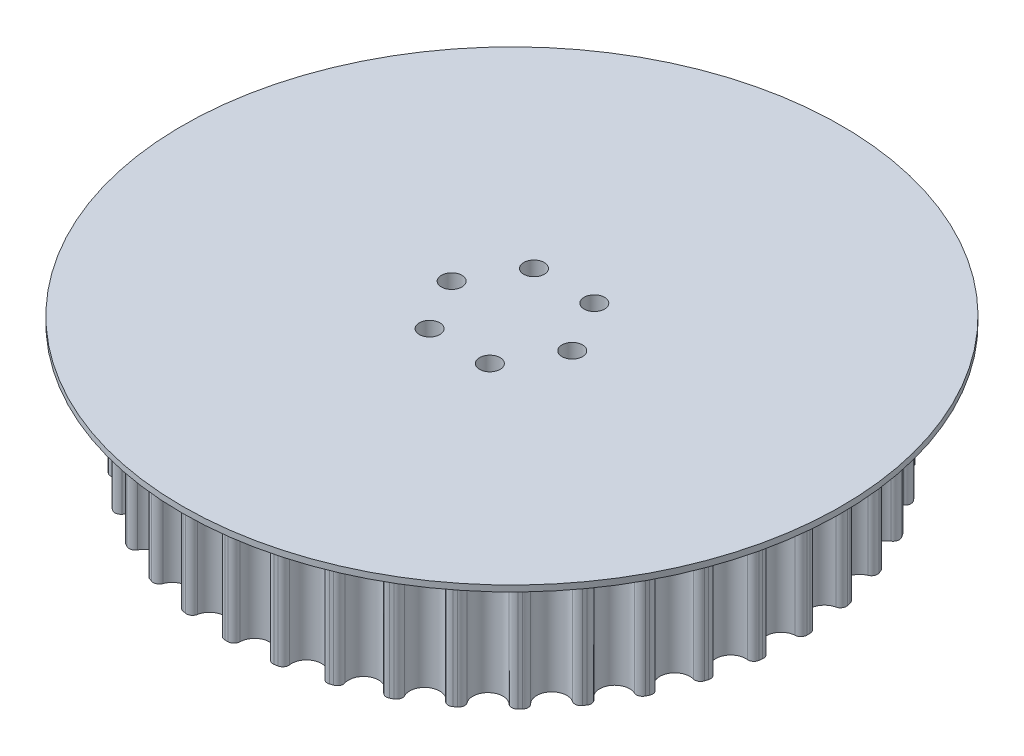
from build123d import *

# Parameters (mm, degrees)
BOSS_EXTRUDE3_DEPTH = 11
SKETCH2_R           = 54.656342245
BOSS_EXTRUDE2_DEPTH = 1
SKETCH3_R           = 1.7
CUT_EXTRUDE1_DEPTH  = 81.645095915
SKETCH4_R           = 3
CUT_EXTRUDE2_DEPTH  = 13
SKETCH6_R           = 1.985
CUT_EXTRUDE3_DEPTH  = 20


with BuildPart() as part:
    # Sketch5 → Boss-Extrude3 (new, symmetric)
    with BuildSketch(Plane(origin=(0, 0, 0), x_dir=(1, 0, 0), z_dir=(0, 1, 0))):
        with BuildLine():
            ThreePointArc((46.375129355, 0.610310087), (47.056181167, 0.935095402), (47.316413888, 1.643329827))
            ThreePointArc((47.316413888, 1.643329827), (47.311662479, 1.774866077), (47.30654541, 1.906388609))
            ThreePointArc((47.30654541, 1.906388609), (47.301062719, 2.037896407), (47.29521445, 2.169388454))
            ThreePointArc((47.29521445, 2.169388454), (46.978836389, 2.85438626), (46.273858659, 3.123316493))
            ThreePointArc((46.273858659, 3.123316493), (43.747034413, 5.311851679), (45.676682987, 8.041500632))
            ThreePointArc((45.676682987, 8.041500632), (46.296816128, 8.471328455), (46.440070113, 9.212135695))
            ThreePointArc((46.440070113, 9.212135695), (46.414280335, 9.341206405), (46.388131833, 9.470204919))
            ThreePointArc((46.388131833, 9.470204919), (46.361624807, 9.59913024), (46.334759464, 9.727981372))
            ThreePointArc((46.334759464, 9.727981372), (45.91259704, 10.353358026), (45.173609143, 10.505719303))
            ThreePointArc((45.173609143, 10.505719303), (42.328440876, 12.260582418), (43.795234522, 15.264420534))
            ThreePointArc((43.795234522, 15.264420534), (44.33838787, 15.788158551), (44.360952916, 16.542352087))
            ThreePointArc((44.360952916, 16.542352087), (44.314792711, 16.665614394), (44.268290008, 16.788747897))
            ThreePointArc((44.268290008, 16.788747897), (44.221445165, 16.911751643), (44.174258546, 17.034624682))
            ThreePointArc((44.174258546, 17.034624682), (43.657245545, 17.584183257), (42.903386879, 17.616029501))
            ThreePointArc((42.903386879, 17.616029501), (39.813562954, 18.891770514), (40.779512488, 22.091999962))
            ThreePointArc((40.779512488, 22.091999962), (41.231618657, 22.696083634), (41.132910339, 23.44413025))
            ThreePointArc((41.132910339, 23.44413025), (41.067575233, 23.558391725), (41.001922725, 23.672471122))
            ThreePointArc((41.001922725, 23.672471122), (40.935953322, 23.786367561), (40.869667536, 23.900080161))
            ThreePointArc((40.869667536, 23.900080161), (40.271194322, 24.359587379), (39.521989432, 24.270093788))
            ThreePointArc((39.521989432, 24.270093788), (36.267534664, 25.033671676), (36.707622501, 28.347408196))
            ThreePointArc((36.707622501, 28.347408196), (37.056972178, 29.016192073), (36.839546992, 29.738717753))
            ThreePointArc((36.839546992, 29.738717753), (36.756729128, 29.841019084), (36.67362718, 29.94308978))
            ThreePointArc((36.67362718, 29.94308978), (36.590241791, 30.044929054), (36.506573604, 30.146536117))
            ThreePointArc((36.506573604, 30.146536117), (35.84214032, 30.504090983), (35.116993217, 30.295575394))
            ThreePointArc((35.116993217, 30.295575394), (31.782196277, 30.527213892), (31.685024373, 33.868633447))
            ThreePointArc((31.685024373, 33.868633447), (31.922569585, 34.584796378), (31.592058728, 35.263088088))
            ThreePointArc((31.592058728, 35.263088088), (31.493903046, 35.350779724), (31.395503956, 35.438198142))
            ThreePointArc((31.395503956, 35.438198142), (31.296862217, 35.525342666), (31.197978592, 35.612212624))
            ThreePointArc((31.197978592, 35.612212624), (30.48479371, 35.858554654), (29.802485325, 35.536417511))
            ThreePointArc((29.802485325, 35.536417511), (26.473715701, 35.230117303), (25.841800757, 38.512678883))
            ThreePointArc((25.841800757, 38.512678883), (25.961389208, 39.257672623), (25.526352737, 39.874162964))
            ThreePointArc((25.526352737, 39.874162964), (25.415401418, 39.944973738), (25.30425367, 40.015475786))
            ThreePointArc((25.30425367, 40.015475786), (25.192910351, 40.085668564), (25.081372321, 40.155551529))
            ThreePointArc((25.081372321, 40.155551529), (24.337906956, 40.284300594), (23.716108717, 39.856885082))
            ThreePointArc((23.716108717, 39.856885082), (20.479579795, 39.020579181), (19.329288075, 42.159266165))
            ThreePointArc((19.329288075, 42.159266165), (19.327822487, 42.913795769), (18.799527619, 43.452517964))
            ThreePointArc((18.799527619, 43.452517964), (18.678654244, 43.504613914), (18.557636506, 43.556373626))
            ThreePointArc((18.557636506, 43.556373626), (18.43647534, 43.607796702), (18.315171683, 43.658882743))
            ThreePointArc((18.315171683, 43.658882743), (17.560681197, 43.66670431), (17.015497351, 43.145080264))
            ThreePointArc((17.015497351, 43.145080264), (13.955033529, 41.800428555), (12.316156985, 44.713950599))
            ThreePointArc((12.316156985, 44.713950599), (12.193675316, 45.458474146), (11.585804611, 45.905475574))
            ThreePointArc((11.585804611, 45.905475574), (11.458139736, 45.937507442), (11.330386304, 45.969184269))
            ThreePointArc((11.330386304, 45.969184269), (11.202545302, 46.000505811), (11.074617718, 46.031471827))
            ThreePointArc((11.074617718, 46.031471827), (10.328643018, 45.918163321), (9.874193542, 45.315840531))
            ThreePointArc((9.874193542, 45.315840531), (7.069059225, 43.497668787), (4.984043899, 46.1105672))
            ThreePointArc((4.984043899, 46.1105672), (4.74371836, 46.825801921), (4.072015349, 47.169505479))
            ThreePointArc((4.072015349, 47.169505479), (3.940865428, 47.180643656), (3.809685049, 47.191417186))
            ThreePointArc((3.809685049, 47.191417186), (3.678475225, 47.201825983), (3.547236972, 47.21186997))
            ThreePointArc((3.547236972, 47.21186997), (2.829098411, 46.980366022), (2.477153306, 46.312944331))
            ThreePointArc((2.477153306, 46.312944331), (0, 44.068342245), (-2.477153306, 46.312944331))
            ThreePointArc((-2.477153306, 46.312944331), (-2.829098411, 46.980366022), (-3.547236972, 47.21186997))
            ThreePointArc((-3.547236972, 47.21186997), (-3.678475225, 47.201825983), (-3.809685049, 47.191417186))
            ThreePointArc((-3.809685049, 47.191417186), (-3.940865428, 47.180643656), (-4.072015349, 47.169505479))
            ThreePointArc((-4.072015349, 47.169505479), (-4.74371836, 46.825801921), (-4.984043899, 46.1105672))
            ThreePointArc((-4.984043899, 46.1105672), (-7.069059225, 43.497668787), (-9.874193542, 45.315840531))
            ThreePointArc((-9.874193542, 45.315840531), (-10.328643018, 45.918163321), (-11.074617718, 46.031471827))
            ThreePointArc((-11.074617718, 46.031471827), (-11.202545302, 46.000505811), (-11.330386304, 45.969184269))
            ThreePointArc((-11.330386304, 45.969184269), (-11.458139736, 45.937507442), (-11.585804611, 45.905475574))
            ThreePointArc((-11.585804611, 45.905475574), (-12.193675316, 45.458474146), (-12.316156985, 44.713950599))
            ThreePointArc((-12.316156985, 44.713950599), (-13.955033529, 41.800428555), (-17.015497351, 43.145080264))
            ThreePointArc((-17.015497351, 43.145080264), (-17.560681197, 43.66670431), (-18.315171683, 43.658882743))
            ThreePointArc((-18.315171683, 43.658882743), (-18.43647534, 43.607796702), (-18.557636506, 43.556373626))
            ThreePointArc((-18.557636506, 43.556373626), (-18.678654244, 43.504613914), (-18.799527619, 43.452517964))
            ThreePointArc((-18.799527619, 43.452517964), (-19.327822487, 42.913795769), (-19.329288075, 42.159266165))
            ThreePointArc((-19.329288075, 42.159266165), (-20.479579795, 39.020579181), (-23.716108717, 39.856885082))
            ThreePointArc((-23.716108717, 39.856885082), (-24.337906956, 40.284300594), (-25.081372321, 40.155551529))
            ThreePointArc((-25.081372321, 40.155551529), (-25.192910351, 40.085668564), (-25.30425367, 40.015475786))
            ThreePointArc((-25.30425367, 40.015475786), (-25.415401418, 39.944973738), (-25.526352737, 39.874162964))
            ThreePointArc((-25.526352737, 39.874162964), (-25.961389208, 39.257672623), (-25.841800757, 38.512678883))
            ThreePointArc((-25.841800757, 38.512678883), (-26.473715701, 35.230117303), (-29.802485325, 35.536417511))
            ThreePointArc((-29.802485325, 35.536417511), (-30.48479371, 35.858554654), (-31.197978592, 35.612212624))
            ThreePointArc((-31.197978592, 35.612212624), (-31.296862217, 35.525342666), (-31.395503956, 35.438198142))
            ThreePointArc((-31.395503956, 35.438198142), (-31.493903046, 35.350779724), (-31.592058728, 35.263088088))
            ThreePointArc((-31.592058728, 35.263088088), (-31.922569585, 34.584796378), (-31.685024373, 33.868633447))
            ThreePointArc((-31.685024373, 33.868633447), (-31.782196277, 30.527213892), (-35.116993217, 30.295575394))
            ThreePointArc((-35.116993217, 30.295575394), (-35.84214032, 30.504090983), (-36.506573604, 30.146536117))
            ThreePointArc((-36.506573604, 30.146536117), (-36.590241791, 30.044929054), (-36.67362718, 29.94308978))
            ThreePointArc((-36.67362718, 29.94308978), (-36.756729128, 29.841019084), (-36.839546992, 29.738717753))
            ThreePointArc((-36.839546992, 29.738717753), (-37.056972178, 29.016192073), (-36.707622501, 28.347408196))
            ThreePointArc((-36.707622501, 28.347408196), (-36.267534664, 25.033671676), (-39.521989432, 24.270093788))
            ThreePointArc((-39.521989432, 24.270093788), (-40.271194322, 24.359587379), (-40.869667536, 23.900080161))
            ThreePointArc((-40.869667536, 23.900080161), (-40.935953322, 23.786367561), (-41.001922725, 23.672471122))
            ThreePointArc((-41.001922725, 23.672471122), (-41.067575233, 23.558391725), (-41.132910339, 23.44413025))
            ThreePointArc((-41.132910339, 23.44413025), (-41.231618657, 22.696083634), (-40.779512488, 22.091999962))
            ThreePointArc((-40.779512488, 22.091999962), (-39.813562954, 18.891770514), (-42.903386879, 17.616029501))
            ThreePointArc((-42.903386879, 17.616029501), (-43.657245545, 17.584183257), (-44.174258546, 17.034624682))
            ThreePointArc((-44.174258546, 17.034624682), (-44.221445165, 16.911751643), (-44.268290008, 16.788747897))
            ThreePointArc((-44.268290008, 16.788747897), (-44.314792711, 16.665614394), (-44.360952916, 16.542352087))
            ThreePointArc((-44.360952916, 16.542352087), (-44.33838787, 15.788158551), (-43.795234522, 15.264420534))
            ThreePointArc((-43.795234522, 15.264420534), (-42.328440876, 12.260582418), (-45.173609143, 10.505719303))
            ThreePointArc((-45.173609143, 10.505719303), (-45.91259704, 10.353358026), (-46.334759464, 9.727981372))
            ThreePointArc((-46.334759464, 9.727981372), (-46.361624807, 9.59913024), (-46.388131833, 9.470204919))
            ThreePointArc((-46.388131833, 9.470204919), (-46.414280335, 9.341206405), (-46.440070113, 9.212135695))
            ThreePointArc((-46.440070113, 9.212135695), (-46.296816128, 8.471328455), (-45.676682987, 8.041500632))
            ThreePointArc((-45.676682987, 8.041500632), (-43.747034413, 5.311851679), (-46.273858659, 3.123316493))
            ThreePointArc((-46.273858659, 3.123316493), (-46.978836389, 2.85438626), (-47.29521445, 2.169388454))
            ThreePointArc((-47.29521445, 2.169388454), (-47.301062719, 2.037896407), (-47.30654541, 1.906388609))
            ThreePointArc((-47.30654541, 1.906388609), (-47.311662479, 1.774866077), (-47.316413888, 1.643329827))
            ThreePointArc((-47.316413888, 1.643329827), (-47.056181167, 0.935095402), (-46.375129355, 0.610310087))
            ThreePointArc((-46.375129355, 0.610310087), (-44.032602739, -1.77445323), (-46.175639542, -4.339978573))
            ThreePointArc((-46.175639542, -4.339978573), (-46.828348552, -4.718512611), (-47.030748225, -5.445390485))
            ThreePointArc((-47.030748225, -5.445390485), (-47.015427953, -5.576117873), (-46.99974431, -5.706802165))
            ThreePointArc((-46.99974431, -5.706802165), (-46.983697417, -5.83744235), (-46.967287398, -5.96803742))
            ThreePointArc((-46.967287398, -5.96803742), (-46.59681583, -6.625356131), (-45.872484232, -6.836687168))
            ThreePointArc((-45.872484232, -6.836687168), (-43.177749782, -8.814800731), (-44.881495615, -11.690870473))
            ThreePointArc((-44.881495615, -11.690870473), (-45.465031086, -12.169204484), (-45.548210325, -12.919136671))
            ThreePointArc((-45.548210325, -12.919136671), (-45.512118299, -13.045713629), (-45.47567452, -13.172189761))
            ThreePointArc((-45.47567452, -13.172189761), (-45.438879271, -13.298564087), (-45.401732835, -13.424835632))
            ThreePointArc((-45.401732835, -13.424835632), (-44.93061744, -14.01421442), (-44.181765864, -14.106617816))
            ThreePointArc((-44.181765864, -14.106617816), (-41.204615787, -15.626849524), (-42.424944528, -18.73897497))
            ThreePointArc((-42.424944528, -18.73897497), (-42.924193196, -19.304720352), (-42.885997703, -20.058284003))
            ThreePointArc((-42.885997703, -20.058284003), (-42.830068687, -20.177432255), (-42.773808648, -20.29642456))
            ThreePointArc((-42.773808648, -20.29642456), (-42.717218019, -20.41526), (-42.66029724, -20.533937654))
            ThreePointArc((-42.66029724, -20.533937654), (-42.10073966, -21.040111918), (-41.346762967, -21.011194474))
            ThreePointArc((-41.346762967, -21.011194474), (-38.164303887, -22.034171122), (-38.869609662, -25.301749857))
            ThreePointArc((-38.869609662, -25.301749857), (-39.271641249, -25.940254104), (-39.113060268, -26.677932316))
            ThreePointArc((-39.113060268, -26.677932316), (-39.038742794, -26.786565984), (-38.964123599, -26.894992625))
            ThreePointArc((-38.964123599, -26.894992625), (-38.889203259, -27.003211402), (-38.813982354, -27.111221476))
            ThreePointArc((-38.813982354, -27.111221476), (-38.180474836, -27.521081568), (-37.440900628, -27.37159223))
            ThreePointArc((-37.440900628, -27.37159223), (-34.135556562, -27.870819263), (-34.307572323, -31.209222714))
            ThreePointArc((-34.307572323, -31.209222714), (-34.601974422, -31.903948901), (-34.327115117, -32.606636195))
            ThreePointArc((-34.327115117, -32.606636195), (-34.236333969, -32.701941724), (-34.145288216, -32.796994508))
            ThreePointArc((-34.145288216, -32.796994508), (-34.053978563, -32.891793812), (-33.962405714, -32.986338903))
            ThreePointArc((-33.962405714, -32.986338903), (-33.27135577, -33.289269662), (-32.56533863, -33.023080126))
            ThreePointArc((-32.56533863, -33.023080126), (-29.222716254, -32.985627824), (-28.856986881, -36.308393096))
            ThreePointArc((-28.856986881, -36.308393096), (-29.036134634, -37.041348179), (-28.652115715, -37.690845324))
            ThreePointArc((-28.652115715, -37.690845324), (-28.547222077, -37.770354351), (-28.442107804, -37.849571461))
            ThreePointArc((-28.442107804, -37.849571461), (-28.336773709, -37.928496041), (-28.231220606, -38.00712748))
            ThreePointArc((-28.231220606, -38.00712748), (-27.500526065, -38.195283158), (-26.846351467, -37.819287593))
            ThreePointArc((-26.846351467, -37.819287593), (-23.553022944, -37.246125952), (-22.659020638, -40.467195169))
            ThreePointArc((-22.659020638, -40.467195169), (-22.71827421, -41.219395996), (-22.235041567, -41.798881357))
            ThreePointArc((-22.235041567, -41.798881357), (-22.118752129, -41.860534641), (-22.00229174, -41.921864395))
            ThreePointArc((-22.00229174, -41.921864395), (-21.885661301, -41.982870144), (-21.768861713, -42.043551418))
            ThreePointArc((-21.768861713, -42.043551418), (-21.017447181, -42.112058883), (-20.432057902, -41.635995376))
            ThreePointArc((-20.432057902, -41.635995376), (-17.273318712, -40.541968981), (-15.874197662, -43.577918143))
            ThreePointArc((-15.874197662, -43.577918143), (-15.812022418, -44.329883109), (-15.242091521, -44.824348319))
            ThreePointArc((-15.242091521, -44.824348319), (-15.117418119, -44.866549071), (-14.992627877, -44.908403061))
            ThreePointArc((-14.992627877, -44.908403061), (-14.867721761, -44.949909964), (-14.742700736, -44.99106946))
            ThreePointArc((-14.742700736, -44.99106946), (-13.990027455, -44.938154403), (-13.48858477, -44.37435275))
            ThreePointArc((-13.48858477, -44.37435275), (-10.546244598, -42.78779631), (-8.678241305, -45.559995928))
            ThreePointArc((-8.678241305, -45.559995928), (-8.496247551, -46.292249534), (-7.854379312, -46.688888205))
            ThreePointArc((-7.854379312, -46.688888205), (-7.72455092, -46.710543448), (-7.594662828, -46.731837677))
            ThreePointArc((-7.594662828, -46.731837677), (-7.464716038, -46.752770727), (-7.334711554, -46.773342435))
            ThreePointArc((-7.334711554, -46.773342435), (-6.600273367, -46.60037533), (-6.195764378, -45.963437696))
            ThreePointArc((-6.195764378, -45.963437696), (-3.546028289, -43.92544219), (-1.257523057, -46.36209375))
            ThreePointArc((-1.257523057, -46.36209375), (-0.960424335, -47.055671013), (-0.263242804, -47.34421041))
            ThreePointArc((-0.263242804, -47.34421041), (-0.131621911, -47.344759286), (0, -47.344942245))
            ThreePointArc((0, -47.344942245), (0.131621911, -47.344759286), (0.263242804, -47.34421041))
            ThreePointArc((0.263242804, -47.34421041), (0.960424335, -47.055671013), (1.257523057, -46.36209375))
            ThreePointArc((1.257523057, -46.36209375), (3.546028289, -43.92544219), (6.195764378, -45.963437696))
            ThreePointArc((6.195764378, -45.963437696), (6.600273367, -46.60037533), (7.334711554, -46.773342435))
            ThreePointArc((7.334711554, -46.773342435), (7.464716038, -46.752770727), (7.594662828, -46.731837677))
            ThreePointArc((7.594662828, -46.731837677), (7.72455092, -46.710543448), (7.854379312, -46.688888205))
            ThreePointArc((7.854379312, -46.688888205), (8.496247551, -46.292249534), (8.678241305, -45.559995928))
            ThreePointArc((8.678241305, -45.559995928), (10.546244598, -42.78779631), (13.48858477, -44.37435275))
            ThreePointArc((13.48858477, -44.37435275), (13.990027455, -44.938154403), (14.742700736, -44.99106946))
            ThreePointArc((14.742700736, -44.99106946), (14.867721761, -44.949909964), (14.992627877, -44.908403061))
            ThreePointArc((14.992627877, -44.908403061), (15.117418119, -44.866549071), (15.242091521, -44.824348319))
            ThreePointArc((15.242091521, -44.824348319), (15.812022418, -44.329883109), (15.874197662, -43.577918143))
            ThreePointArc((15.874197662, -43.577918143), (17.273318712, -40.541968981), (20.432057902, -41.635995376))
            ThreePointArc((20.432057902, -41.635995376), (21.017447181, -42.112058883), (21.768861713, -42.043551418))
            ThreePointArc((21.768861713, -42.043551418), (21.885661301, -41.982870144), (22.00229174, -41.921864395))
            ThreePointArc((22.00229174, -41.921864395), (22.118752129, -41.860534641), (22.235041567, -41.798881357))
            ThreePointArc((22.235041567, -41.798881357), (22.71827421, -41.219395996), (22.659020638, -40.467195169))
            ThreePointArc((22.659020638, -40.467195169), (23.553022944, -37.246125952), (26.846351467, -37.819287593))
            ThreePointArc((26.846351467, -37.819287593), (27.500526065, -38.195283158), (28.231220606, -38.00712748))
            ThreePointArc((28.231220606, -38.00712748), (28.336773709, -37.928496041), (28.442107804, -37.849571461))
            ThreePointArc((28.442107804, -37.849571461), (28.547222077, -37.770354351), (28.652115715, -37.690845324))
            ThreePointArc((28.652115715, -37.690845324), (29.036134634, -37.041348179), (28.856986881, -36.308393096))
            ThreePointArc((28.856986881, -36.308393096), (29.222716254, -32.985627824), (32.56533863, -33.023080126))
            ThreePointArc((32.56533863, -33.023080126), (33.27135577, -33.289269662), (33.962405714, -32.986338903))
            ThreePointArc((33.962405714, -32.986338903), (34.053978563, -32.891793812), (34.145288216, -32.796994508))
            ThreePointArc((34.145288216, -32.796994508), (34.236333969, -32.701941724), (34.327115117, -32.606636195))
            ThreePointArc((34.327115117, -32.606636195), (34.601974422, -31.903948901), (34.307572323, -31.209222714))
            ThreePointArc((34.307572323, -31.209222714), (34.135556562, -27.870819263), (37.440900628, -27.37159223))
            ThreePointArc((37.440900628, -27.37159223), (38.180474836, -27.521081568), (38.813982354, -27.111221476))
            ThreePointArc((38.813982354, -27.111221476), (38.889203259, -27.003211402), (38.964123599, -26.894992625))
            ThreePointArc((38.964123599, -26.894992625), (39.038742794, -26.786565984), (39.113060268, -26.677932316))
            ThreePointArc((39.113060268, -26.677932316), (39.271641249, -25.940254104), (38.869609662, -25.301749857))
            ThreePointArc((38.869609662, -25.301749857), (38.164303887, -22.034171122), (41.346762967, -21.011194474))
            ThreePointArc((41.346762967, -21.011194474), (42.10073966, -21.040111918), (42.66029724, -20.533937654))
            ThreePointArc((42.66029724, -20.533937654), (42.717218019, -20.41526), (42.773808648, -20.29642456))
            ThreePointArc((42.773808648, -20.29642456), (42.830068687, -20.177432255), (42.885997703, -20.058284003))
            ThreePointArc((42.885997703, -20.058284003), (42.924193196, -19.304720352), (42.424944528, -18.73897497))
            ThreePointArc((42.424944528, -18.73897497), (41.204615787, -15.626849524), (44.181765864, -14.106617816))
            ThreePointArc((44.181765864, -14.106617816), (44.93061744, -14.01421442), (45.401732835, -13.424835632))
            ThreePointArc((45.401732835, -13.424835632), (45.438879271, -13.298564087), (45.47567452, -13.172189761))
            ThreePointArc((45.47567452, -13.172189761), (45.512118299, -13.045713629), (45.548210325, -12.919136671))
            ThreePointArc((45.548210325, -12.919136671), (45.465031086, -12.169204484), (44.881495615, -11.690870473))
            ThreePointArc((44.881495615, -11.690870473), (43.177749782, -8.814800731), (45.872484232, -6.836687168))
            ThreePointArc((45.872484232, -6.836687168), (46.59681583, -6.625356131), (46.967287398, -5.96803742))
            ThreePointArc((46.967287398, -5.96803742), (46.983697417, -5.83744235), (46.99974431, -5.706802165))
            ThreePointArc((46.99974431, -5.706802165), (47.015427953, -5.576117873), (47.030748225, -5.445390485))
            ThreePointArc((47.030748225, -5.445390485), (46.828348552, -4.718512611), (46.175639542, -4.339978573))
            ThreePointArc((46.175639542, -4.339978573), (44.032602739, -1.77445323), (46.375129355, 0.610310087))
        make_face()
    extrude(amount=BOSS_EXTRUDE3_DEPTH, both=True)

    # Sketch2 → Boss-Extrude2 (add)
    with BuildSketch(Plane(origin=(0, 11, 0), x_dir=(1, 0, 0), z_dir=(0, 1, 0))):
        with Locations(Location((0, 0, 0), (0, 0, 270))):
            Circle(SKETCH2_R)
    extrude(amount=BOSS_EXTRUDE2_DEPTH)

    # Sketch3 → Cut-Extrude1 (cut, through all)
    with BuildSketch(Plane(origin=(0, 12, 0), x_dir=(1, 0, 0), z_dir=(0, 1, 0))):
        with Locations(Location((10, 0, 0), (0, 0, 270))):
            Circle(SKETCH3_R)
        with Locations(Location((5, -8.660254038, 0), (0, 0, 270))):
            Circle(SKETCH3_R)
        with Locations(Location((-5, -8.660254038, 0), (0, 0, 270))):
            Circle(SKETCH3_R)
        with Locations(Location((-10, 0, 0), (0, 0, 270))):
            Circle(SKETCH3_R)
        with Locations(Location((-5, 8.660254038, 0), (0, 0, 270))):
            Circle(SKETCH3_R)
        with Locations(Location((5, 8.660254038, 0), (0, 0, 270))):
            Circle(SKETCH3_R)
    extrude(amount=-CUT_EXTRUDE1_DEPTH, mode=Mode.SUBTRACT)

    # Sketch4 → Cut-Extrude2 (cut)
    with BuildSketch(Plane(origin=(0, -11, 0), x_dir=(1, 0, 0), z_dir=(0, 1, 0))):
        with Locations(Location((5, -8.660254038, 0), (0, 0, 270))):
            Circle(SKETCH4_R)
        with Locations(Location((-5, -8.660254038, 0), (0, 0, 270))):
            Circle(SKETCH4_R)
        with Locations(Location((-10, 0, 0), (0, 0, 270))):
            Circle(SKETCH4_R)
        with Locations(Location((-5, 8.660254038, 0), (0, 0, 270))):
            Circle(SKETCH4_R)
        with Locations(Location((5, 8.660254038, 0), (0, 0, 270))):
            Circle(SKETCH4_R)
        with Locations(Location((10, 0, 0), (0, 0, 270))):
            Circle(SKETCH4_R)
    extrude(amount=CUT_EXTRUDE2_DEPTH, mode=Mode.SUBTRACT)

    # Sketch6 → Cut-Extrude3 (cut)
    with BuildSketch(Plane.XZ.offset(11)):
        with Locations(Location((35, 0, 0), (0, 0, 270))):
            Circle(SKETCH6_R)
        with Locations(Location((-17.5, -30.310889132, 0), (0, 0, 270))):
            Circle(SKETCH6_R)
        with Locations(Location((-17.5, 30.310889132, 0), (0, 0, 270))):
            Circle(SKETCH6_R)
    extrude(amount=-CUT_EXTRUDE3_DEPTH, mode=Mode.SUBTRACT)


solid = part.part
